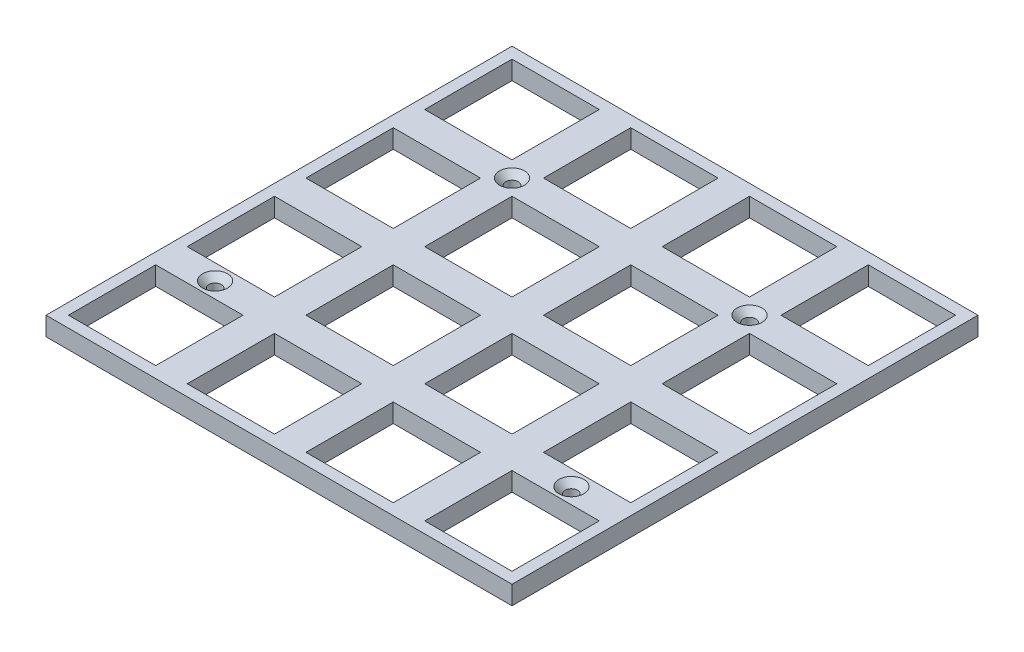
from build123d import *

# Parameters (mm, degrees)
SKETCH1_W                = 75.15
SKETCH1_H                = 75.15
SKETCH1_W_2              = 14
SKETCH1_H_2              = 14
BOSS_EXTRUDE1_DEPTH      = 3
SKETCH2_R                = 1
CUT_EXTRUDE1_DEPTH       = 3
CHAMFER1_SIZE            = 1
CHAMFER1_OF_MIRROR1_SIZE = 1
MOVE_FACE1_BY            = 0.2
MOVE_FACE1_2_BY          = 0.2
MOVE_FACE1_3_BY          = 0.2
MOVE_FACE1_4_BY          = 0.2


with BuildPart() as part:
    # Sketch1 → Boss-Extrude1 (new body)
    with BuildSketch(Plane(origin=(0, 0, 0), x_dir=(1, 0, 0), z_dir=(0, 1, 0))):
        Rectangle(SKETCH1_W, SKETCH1_H)
        with Locations((-9.525, 28.575)):
            Rectangle(SKETCH1_W_2, SKETCH1_H_2, mode=Mode.SUBTRACT)
        with Locations((-28.575, 28.575)):
            Rectangle(SKETCH1_W_2, SKETCH1_H_2, mode=Mode.SUBTRACT)
        with Locations((9.525, 28.575)):
            Rectangle(SKETCH1_W_2, SKETCH1_H_2, mode=Mode.SUBTRACT)
        with Locations((28.575, 28.575)):
            Rectangle(SKETCH1_W_2, SKETCH1_H_2, mode=Mode.SUBTRACT)
        with Locations((-9.525, 9.525)):
            Rectangle(SKETCH1_W_2, SKETCH1_H_2, mode=Mode.SUBTRACT)
        with Locations((9.525, 9.525)):
            Rectangle(SKETCH1_W_2, SKETCH1_H_2, mode=Mode.SUBTRACT)
        with Locations((28.575, 9.525)):
            Rectangle(SKETCH1_W_2, SKETCH1_H_2, mode=Mode.SUBTRACT)
        with Locations((-9.525, -9.525)):
            Rectangle(SKETCH1_W_2, SKETCH1_H_2, mode=Mode.SUBTRACT)
        with Locations((9.525, -9.525)):
            Rectangle(SKETCH1_W_2, SKETCH1_H_2, mode=Mode.SUBTRACT)
        with Locations((28.575, -9.525)):
            Rectangle(SKETCH1_W_2, SKETCH1_H_2, mode=Mode.SUBTRACT)
        with Locations((-9.525, -28.575)):
            Rectangle(SKETCH1_W_2, SKETCH1_H_2, mode=Mode.SUBTRACT)
        with Locations((9.525, -28.575)):
            Rectangle(SKETCH1_W_2, SKETCH1_H_2, mode=Mode.SUBTRACT)
        with Locations((28.575, -28.575)):
            Rectangle(SKETCH1_W_2, SKETCH1_H_2, mode=Mode.SUBTRACT)
        with Locations((-28.575, 9.525)):
            Rectangle(SKETCH1_W_2, SKETCH1_H_2, mode=Mode.SUBTRACT)
        with Locations((-28.575, -9.525)):
            Rectangle(SKETCH1_W_2, SKETCH1_H_2, mode=Mode.SUBTRACT)
        with Locations((-28.575, -28.575)):
            Rectangle(SKETCH1_W_2, SKETCH1_H_2, mode=Mode.SUBTRACT)
    extrude(amount=BOSS_EXTRUDE1_DEPTH)

    # Sketch2 → Cut-Extrude1 (cut)
    with BuildSketch(Plane(origin=(0, 3, 0), x_dir=(1, 0, 0), z_dir=(0, 1, 0))):
        with Locations(Location((-19.05, 19.05, 0), (0, 0, 270))):
            Circle(SKETCH2_R)
        with Locations(Location((-28.575, -19.05, 0), (0, 0, 270))):
            Circle(SKETCH2_R)
    cut_extrude1 = extrude(amount=-CUT_EXTRUDE1_DEPTH, mode=Mode.SUBTRACT)

    # Chamfer1
    chamfer1_edges = [part.edges().sort_by_distance(p)[0] for p in [
        (-19.05, 3, -20.05),
        (-28.575, 3, 18.05),
    ]]
    chamfer(chamfer1_edges, length=CHAMFER1_SIZE)

    # Mirror1: Cut-Extrude1 across plane
    add(cut_extrude1.mirror(Plane(origin=(0, 0, 0), x_dir=(0, 0, 1), z_dir=(1, 0, 0))), mode=Mode.SUBTRACT)

    # Chamfer1 of Mirror1
    chamfer1_of_mirror1_edges = [part.edges().sort_by_distance(p)[0] for p in [
        (19.05, 3, -20.05),
        (28.575, 3, 18.05),
    ]]
    chamfer(chamfer1_of_mirror1_edges, length=CHAMFER1_OF_MIRROR1_SIZE)

    # Move Face1: a face moved inward by 0.2
    extrude(part.faces().sort_by_distance((37.575, 1.5, 0))[0], amount=MOVE_FACE1_BY, dir=(-1, 0, 0), mode=Mode.SUBTRACT)

    # Move Face1 2: a face moved inward by 0.2
    extrude(part.faces().sort_by_distance((0, 1.5, -37.575))[0], amount=MOVE_FACE1_2_BY, dir=(0, 0, 1), mode=Mode.SUBTRACT)

    # Move Face1 3: a face moved inward by 0.2
    extrude(part.faces().sort_by_distance((0, 1.5, 37.575))[0], amount=MOVE_FACE1_3_BY, dir=(0, 0, -1), mode=Mode.SUBTRACT)

    # Move Face1 4: a face moved inward by 0.2
    extrude(part.faces().sort_by_distance((-37.575, 1.5, 0))[0], amount=MOVE_FACE1_4_BY, dir=(1, 0, 0), mode=Mode.SUBTRACT)


solid = part.part
